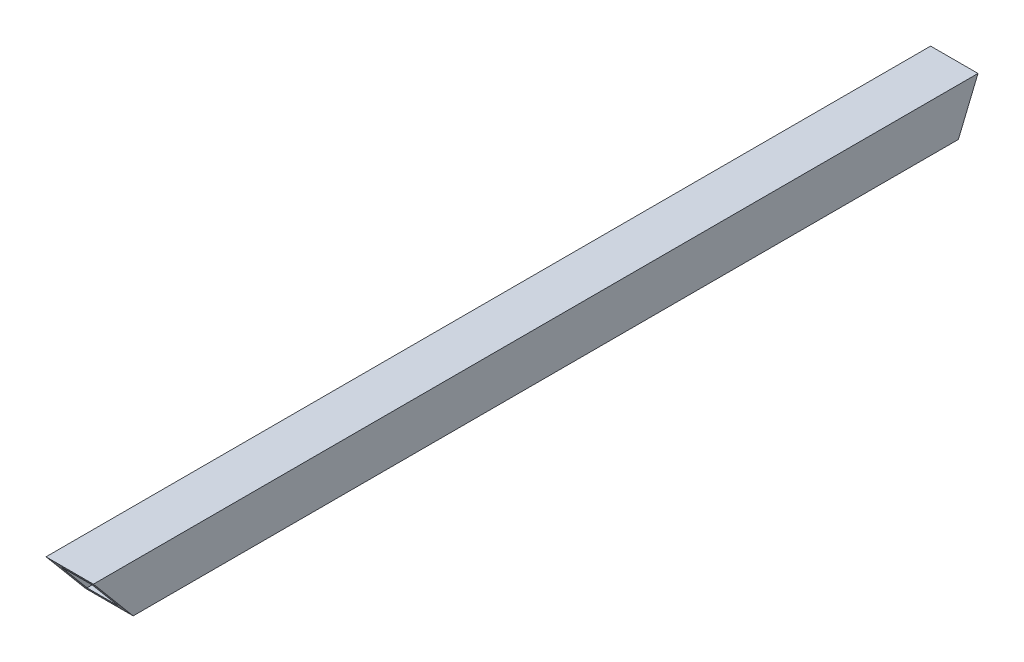
from build123d import *

# Parameters (mm, degrees)
SKETCH1_W           = 19.05
SKETCH1_H           = 19.05
SKETCH1_W_2         = 12.7
SKETCH1_H_2         = 12.7
BOSS_EXTRUDE1_DEPTH = 177.8
CUT_EXTRUDE1_DEPTH  = 180.071125883


with BuildPart() as part:
    # Sketch1 → Boss-Extrude1 (new, symmetric)
    with BuildSketch(Plane.XY):
        Rectangle(SKETCH1_W, SKETCH1_H)
        Rectangle(SKETCH1_W_2, SKETCH1_H_2, mode=Mode.SUBTRACT)
    extrude(amount=BOSS_EXTRUDE1_DEPTH, both=True)

    # Sketch2 → Cut-Extrude1 (cut, through all)
    with BuildSketch(Plane(origin=(9.525, 0, 0), x_dir=(0, 0, -1), z_dir=(1, 0, 0))):
        Polygon((-177.8, 9.525), (-161.815152026, -9.525), (-177.8, -9.525), align=None)
        Polygon((177.8, 9.525), (169.909231637, -9.525), (177.8, -9.525), align=None)
    extrude(amount=-CUT_EXTRUDE1_DEPTH, mode=Mode.SUBTRACT)


solid = part.part
